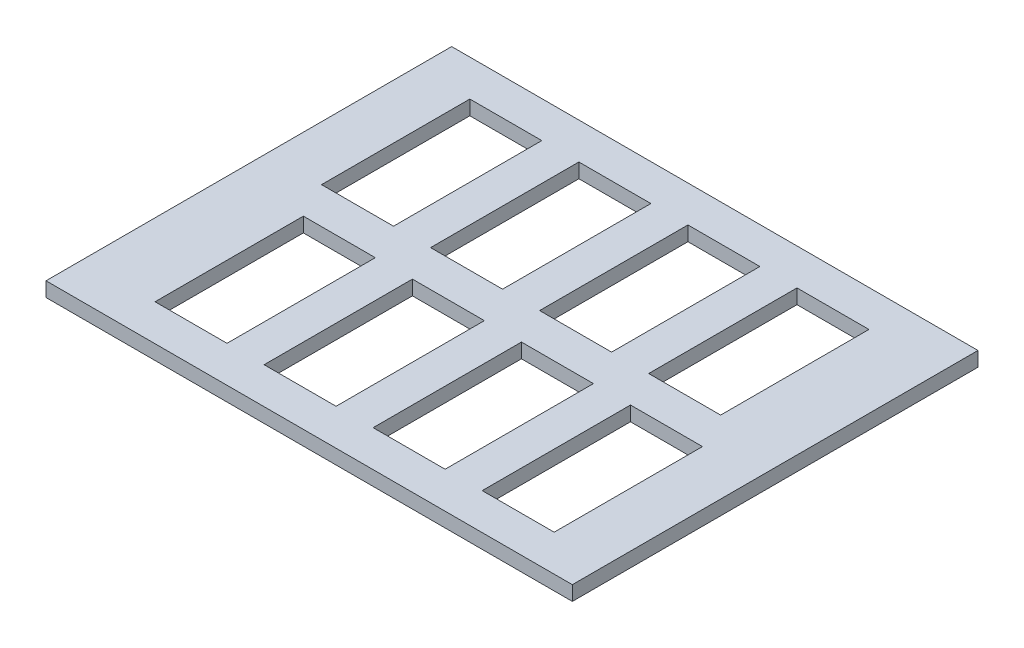
from build123d import *

# Parameters (mm, degrees)
SKETCH2_W           = 144.8
SKETCH2_H           = 111.6
SKETCH2_W_2         = 19.8
SKETCH2_H_2         = 40.8
BOSS_EXTRUDE1_DEPTH = 4


with BuildPart() as part:
    # Sketch2 → Boss-Extrude1 (new body)
    with BuildSketch(Plane(origin=(0, 0, 0), x_dir=(1, 0, 0), z_dir=(0, 1, 0))):
        Rectangle(SKETCH2_W, SKETCH2_H)
        with Locations((-42.5, -25.4)):
            Rectangle(SKETCH2_W_2, SKETCH2_H_2, mode=Mode.SUBTRACT)
        with Locations((-12.5, -25.4)):
            Rectangle(SKETCH2_W_2, SKETCH2_H_2, mode=Mode.SUBTRACT)
        with Locations((17.5, -25.4)):
            Rectangle(SKETCH2_W_2, SKETCH2_H_2, mode=Mode.SUBTRACT)
        with Locations((47.5, -25.4)):
            Rectangle(SKETCH2_W_2, SKETCH2_H_2, mode=Mode.SUBTRACT)
        with Locations((-47.5, 25.4)):
            Rectangle(SKETCH2_W_2, SKETCH2_H_2, mode=Mode.SUBTRACT)
        with Locations((-17.5, 25.4)):
            Rectangle(SKETCH2_W_2, SKETCH2_H_2, mode=Mode.SUBTRACT)
        with Locations((12.5, 25.4)):
            Rectangle(SKETCH2_W_2, SKETCH2_H_2, mode=Mode.SUBTRACT)
        with Locations((42.5, 25.4)):
            Rectangle(SKETCH2_W_2, SKETCH2_H_2, mode=Mode.SUBTRACT)
    extrude(amount=BOSS_EXTRUDE1_DEPTH)


solid = part.part
